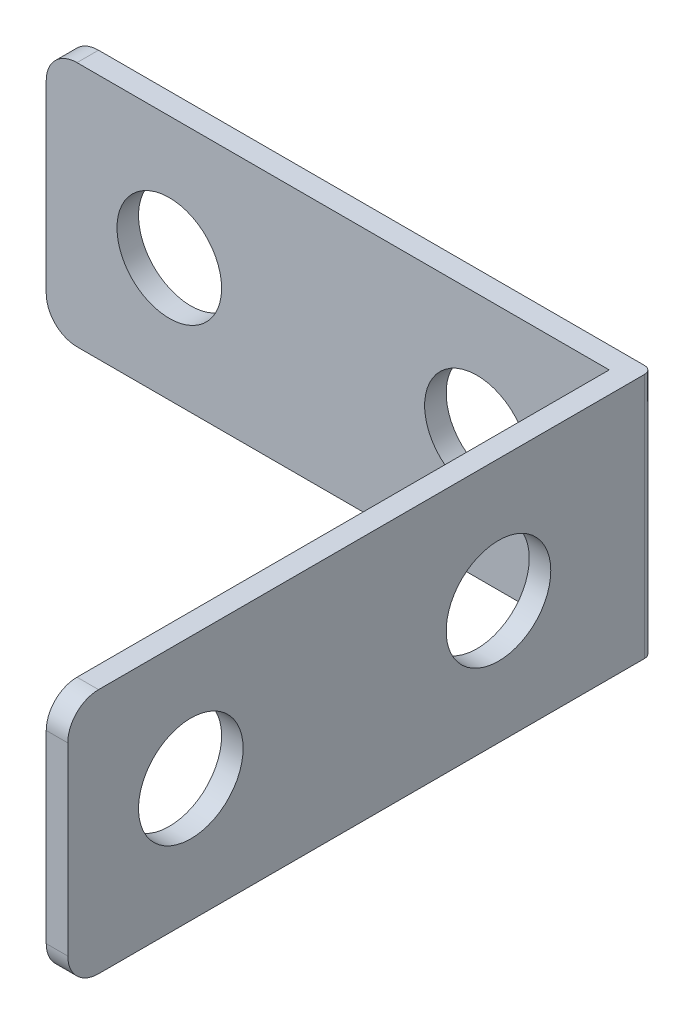
from build123d import *

# Parameters (mm, degrees)
SKETCH_1_W      = 19
SKETCH_1_H      = 8
SKETCH_1_R      = 1.7
EXTRUDE_1_DEPTH = 0.7
SKETCH_2_W      = 19
SKETCH_2_H      = 8
SKETCH_2_R      = 1.7
EXTRUDE_2_DEPTH = 0.7
FILLET_1_R      = 1
FILLET_2_R      = 0.25


with BuildPart() as part:
    # 草图1 → 凸台-拉伸1 (new body)
    with BuildSketch(Plane.XY):
        Rectangle(SKETCH_1_W, SKETCH_1_H)
        with Locations((-5.5, 0)):
            Circle(SKETCH_1_R, mode=Mode.SUBTRACT)
        with Locations((4.5, 0)):
            Circle(SKETCH_1_R, mode=Mode.SUBTRACT)
    extrude(amount=EXTRUDE_1_DEPTH)

    # 草图2 → 凸台-拉伸2 (add)
    with BuildSketch(Plane(origin=(9.5, 0, 0), x_dir=(0, 0, -1), z_dir=(1, 0, 0))):
        with Locations((-9.5, 0)):
            Rectangle(SKETCH_2_W, SKETCH_2_H)
        with Locations((-5, 0)):
            Circle(SKETCH_2_R, mode=Mode.SUBTRACT)
        with Locations((-15, 0)):
            Circle(SKETCH_2_R, mode=Mode.SUBTRACT)
    extrude(amount=-EXTRUDE_2_DEPTH)

    # 圆角1
    fillet_1_edges = [part.edges().sort_by_distance(p)[0] for p in [
        (9.15, 4, 19),
        (9.15, -4, 19),
        (-9.5, -4, 0.35),
        (-9.5, 4, 0.35),
    ]]
    fillet(fillet_1_edges, radius=FILLET_1_R)

    # 圆角2
    fillet_2_edges = [part.edges().sort_by_distance(p)[0] for p in [
        (9.5, 0, 0),
    ]]
    fillet(fillet_2_edges, radius=FILLET_2_R)


solid = part.part
